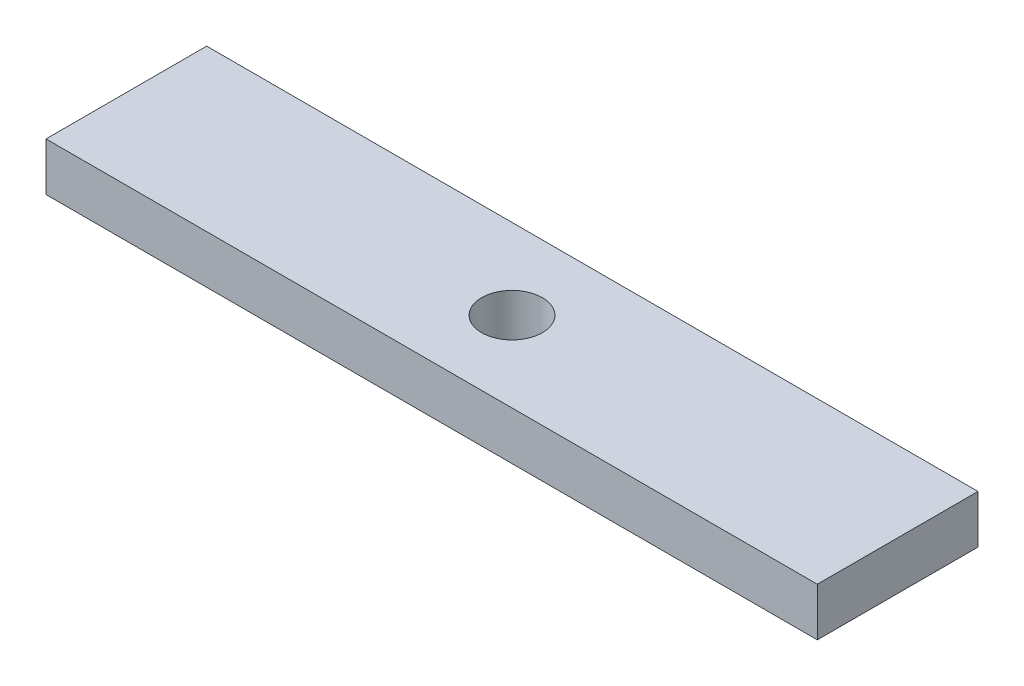
from build123d import *

# Parameters (mm, degrees)
SKETCH1_W              = 152.4
SKETCH1_H              = 31.75
BOSS_EXTRUDE1_DEPTH    = 4.7625
F_12_0MM_DOWEL_HOLE1_D = 12


with BuildPart() as part:
    # Sketch1 → Boss-Extrude1 (new, symmetric)
    with BuildSketch(Plane(origin=(0, 0, 0), x_dir=(1, 0, 0), z_dir=(0, 1, 0))):
        Rectangle(SKETCH1_W, SKETCH1_H)
    extrude(amount=BOSS_EXTRUDE1_DEPTH, both=True)

    # Ø12.0mm Dowel Hole1 (through all)
    with Locations(Plane(origin=(0, -4.7625, 0), x_dir=(-1, 0, 0), z_dir=(0, -1, 0))):
        with Locations((0, 0)):
            Hole(F_12_0MM_DOWEL_HOLE1_D / 2)


solid = part.part
